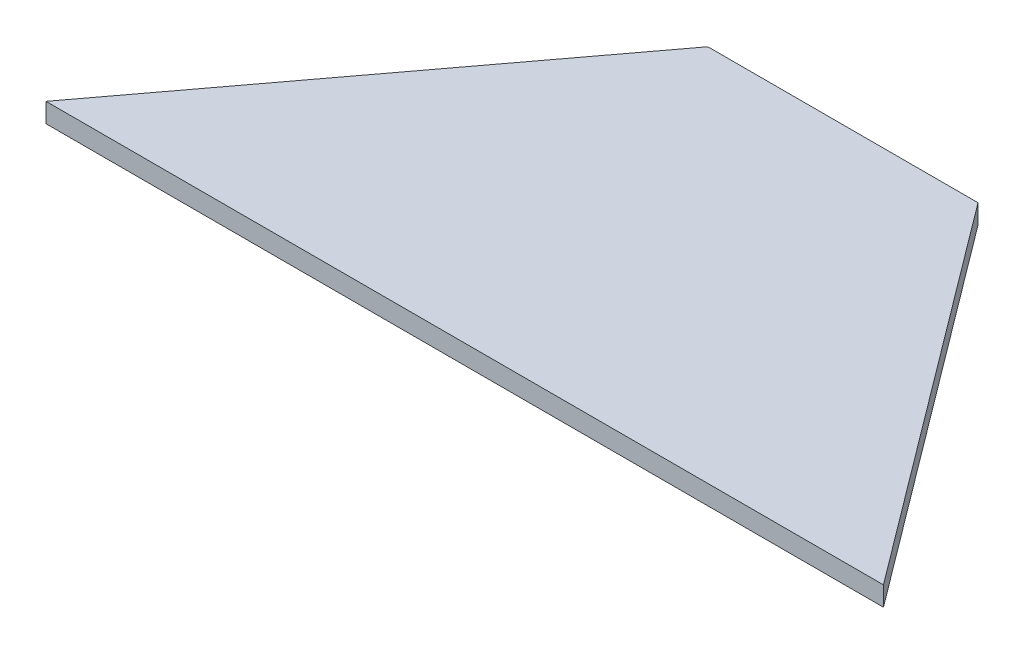
from build123d import *

# Parameters (mm, degrees)
BOSS_EXTRUDE1_DEPTH = 18.25625


with BuildPart() as part:
    # Sketch1 → Boss-Extrude1 (new body)
    with BuildSketch(Plane(origin=(0, 0, 0), x_dir=(1, 0, 0), z_dir=(0, 1, 0))):
        Polygon((393.7, 0), (-393.7, 0), (-127, 355.6), (127, 355.6), align=None)
    extrude(amount=BOSS_EXTRUDE1_DEPTH)


solid = part.part
